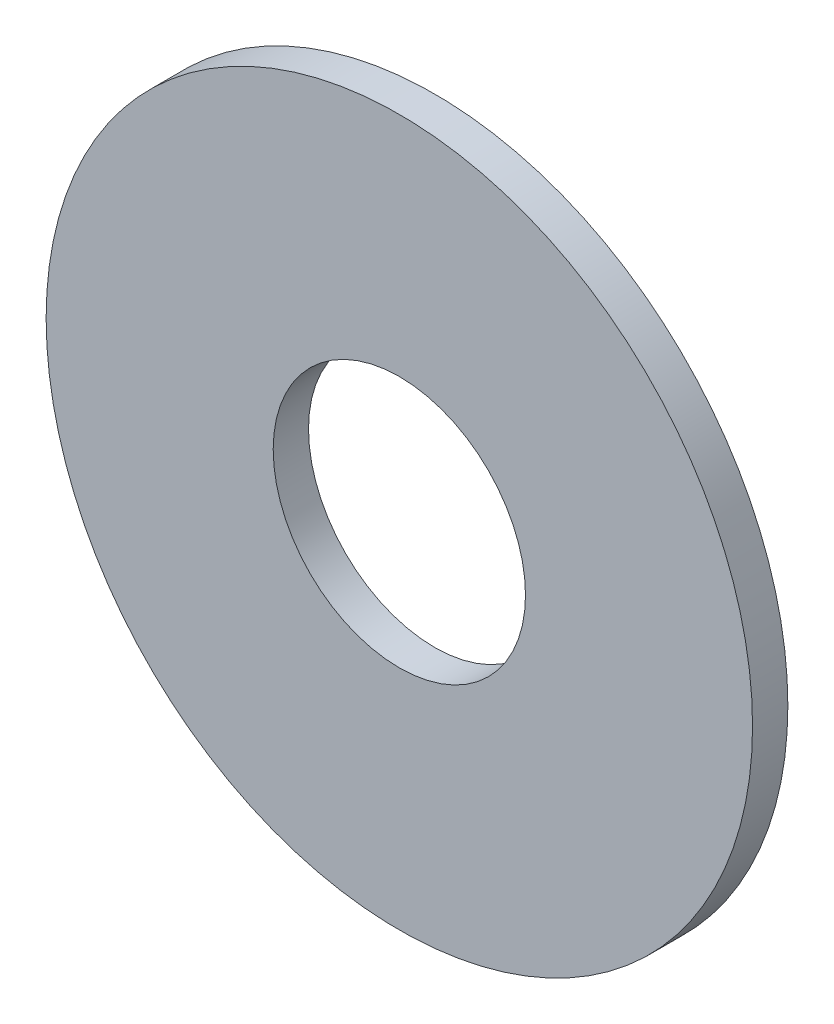
from build123d import *

# Parameters (mm, degrees)
ESQUISSE1_R             = 7
BOSS_EXTRU_1_DEPTH      = 0.7
ESQUISSE2_R             = 2.5
ENL_V_MAT_EXTRU_1_DEPTH = 1.5


with BuildPart() as part:
    # Esquisse1 → Boss.-Extru.1 (new body)
    with BuildSketch(Plane.XY):
        Circle(ESQUISSE1_R)
    extrude(amount=BOSS_EXTRU_1_DEPTH)

    # Esquisse2 → Enlèv. mat.-Extru.1 (cut)
    with BuildSketch(Plane.XY.offset(0.7)):
        Circle(ESQUISSE2_R)
    extrude(amount=-ENL_V_MAT_EXTRU_1_DEPTH, mode=Mode.SUBTRACT)


solid = part.part
